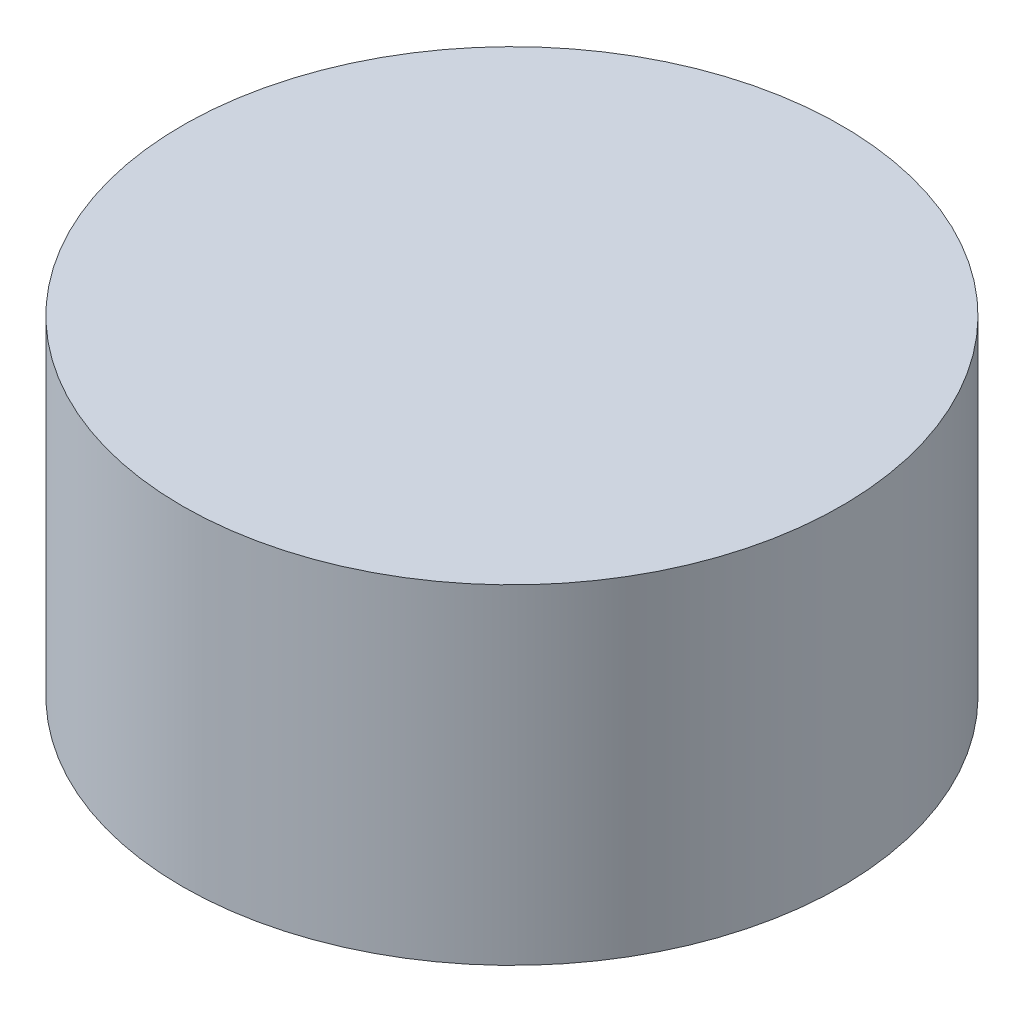
from build123d import *

# Parameters (mm, degrees)
VNT_GOVDE_D24_START = 18
SKETCH1_R           = 12
VNT_GOVDE_D24_DEPTH = 12


with BuildPart() as part:
    # Sketch1 → VNT_govde_D24 (new body)
    with BuildSketch(Plane(origin=(0, 0, 0), x_dir=(1, 0, 0), z_dir=(0, 1, 0)).offset(VNT_GOVDE_D24_START)):
        with Locations(Location((0, 0, 0), (0, 0, 270))):
            Circle(SKETCH1_R)
    extrude(amount=VNT_GOVDE_D24_DEPTH)


solid = part.part
